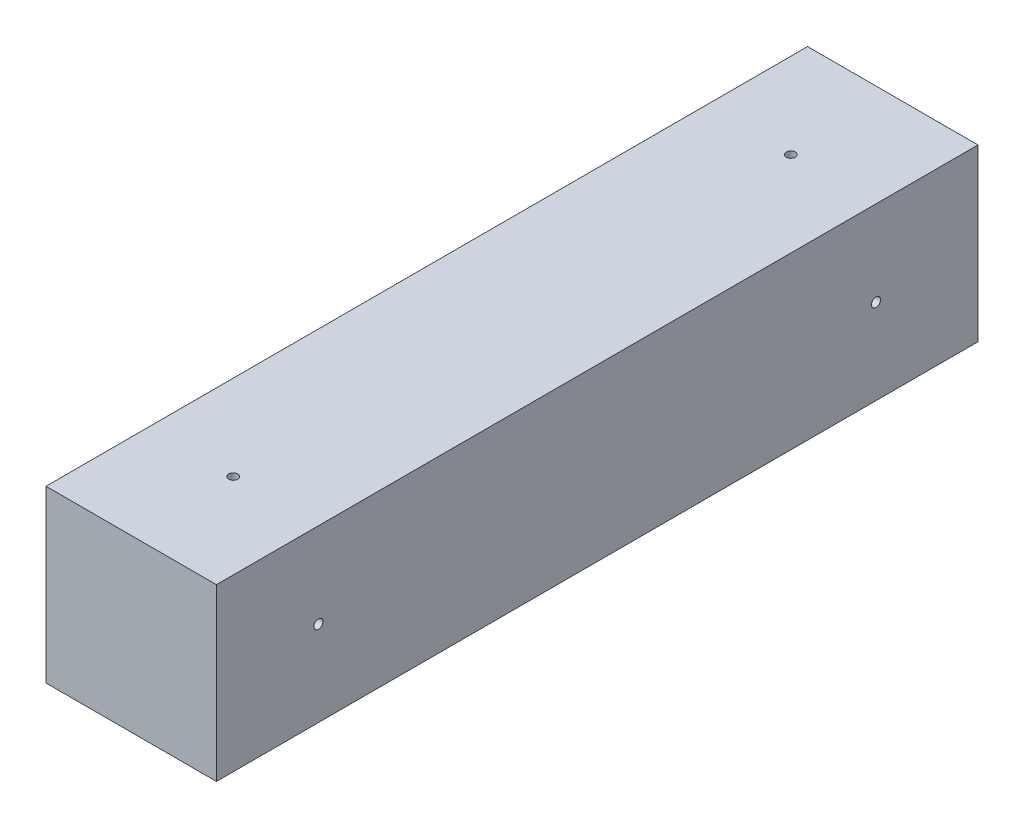
from build123d import *

# Parameters (mm, degrees)
ESQUISSE1_W                              = 50.8
ESQUISSE1_H                              = 50.8
BOSS_EXTRU_1_DEPTH                       = 113.5
TROU_POUR_TARAUDAGE_POUR_TROU_TARAUD_6_D = 2.7051
TROU_POUR_TARAUDAGE_POUR_TROU_TARAUD_2_D = 2.7051


with BuildPart() as part:
    # Esquisse1 → Boss.-Extru.1 (new, symmetric)
    with BuildSketch(Plane.XY):
        Rectangle(ESQUISSE1_W, ESQUISSE1_H)
    extrude(amount=BOSS_EXTRU_1_DEPTH, both=True)

    # Trou pour taraudage pour trou taraud_ _6 (through all)
    with Locations(Plane(origin=(25.4, 0, 0), x_dir=(0, 0, -1), z_dir=(1, 0, 0))):
        with Locations((-83.1, 0), (83.1, 0)):
            Hole(TROU_POUR_TARAUDAGE_POUR_TROU_TARAUD_6_D / 2)

    # Trou pour taraudage pour trou taraud 2 (through all)
    with Locations(Plane(origin=(0, 25.4, 0), x_dir=(1, 0, 0), z_dir=(0, 1, 0))):
        with Locations((0, -83.1), (0, 83.1)):
            Hole(TROU_POUR_TARAUDAGE_POUR_TROU_TARAUD_2_D / 2)


solid = part.part
